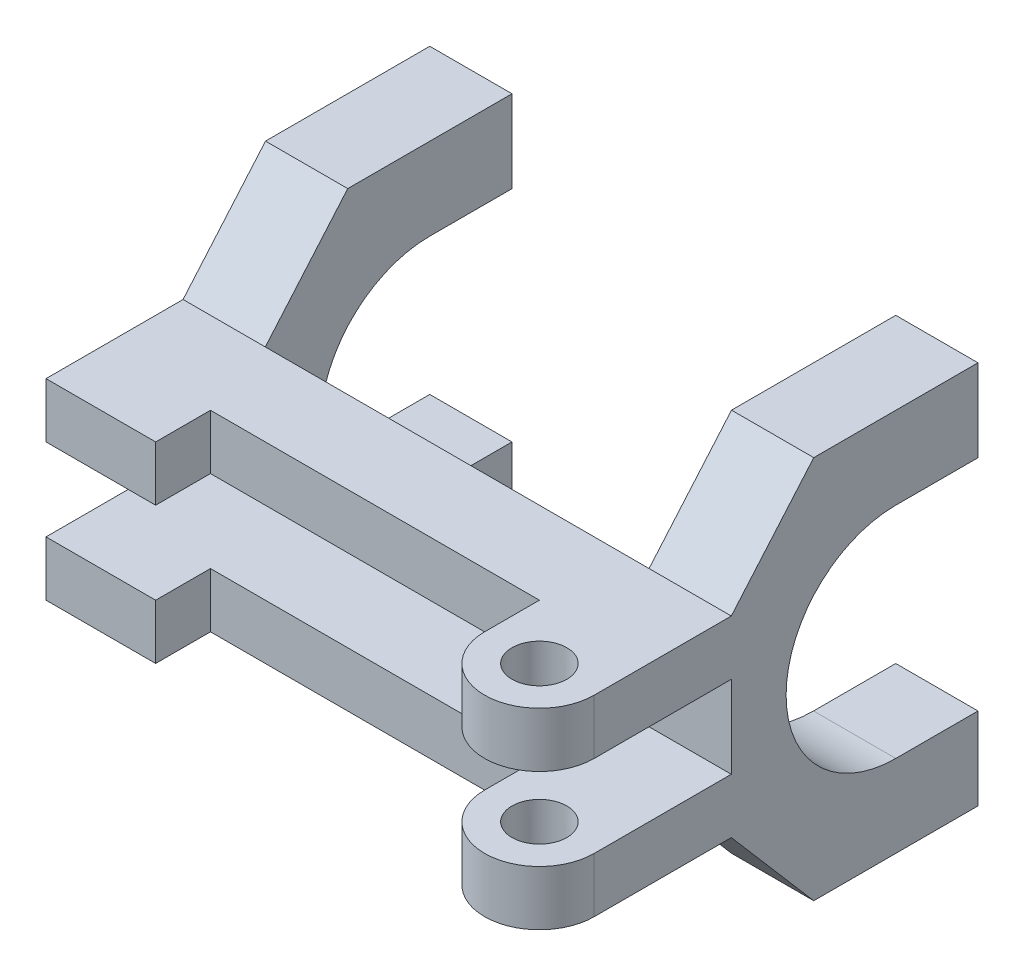
from build123d import *

# Parameters (mm, degrees)
SKETCH1_W           = 12.7
SKETCH1_H           = 44.45
BOSS_EXTRUDE1_DEPTH = 127
SKETCH2_R           = 6.35
CUT_EXTRUDE1_DEPTH  = 142.028625197
SKETCH4_W           = 88.9
SKETCH4_H           = 57.15
CUT_EXTRUDE2_DEPTH  = 147.187978302


with BuildPart() as part:
    # Sketch1 → Boss-Extrude1 (new body)
    with BuildSketch(Plane.YZ):
        with BuildLine():
            ThreePointArc((15.875, -38.1), (8.435512242, -20.139487758), (-9.525, -12.7))
            Line((-9.525, -12.7), (-9.525, 0))
            Line((-9.525, 0), (0, 0))
            Line((0, 0), (0, 44.45))
            Line((0, 44.45), (12.7, 44.45))
            Line((12.7, 44.45), (12.7, 0))
            Line((12.7, 0), (34.925, -19.098767483))
            Line((34.925, -19.098767483), (34.925, -57.15))
            Line((34.925, -57.15), (15.875, -57.15))
            Line((15.875, -57.15), (15.875, -38.1))
        make_face()
        with Locations((6.35, 22.225)):
            Rectangle(SKETCH1_W, SKETCH1_H)
    extrude(amount=-BOSS_EXTRUDE1_DEPTH)

    # Sketch2 → Cut-Extrude1 (cut, through all)
    with BuildSketch(Plane(origin=(0, 12.7, 0), x_dir=(-1, 0, 0), z_dir=(0, 1, 0))):
        with BuildLine():
            Line((101.6, 31.75), (127, 31.75))
            Line((127, 31.75), (127, 44.45))
            Line((127, 44.45), (12.700000053, 44.45))
            ThreePointArc((12.700000053, 44.45), (21.68025614, 40.730256102), (25.4, 31.75))
            Line((25.4, 31.75), (25.4, 19.05))
            Line((25.4, 19.05), (101.6, 19.05))
            Line((101.6, 19.05), (101.6, 31.75))
        make_face()
        with BuildLine():
            ThreePointArc((0, 31.75), (3.719743898, 40.73025614), (12.700000053, 44.45))
            Line((12.700000053, 44.45), (0, 44.45))
            Line((0, 44.45), (0, 31.75))
        make_face()
        with Locations(Location((12.7, 31.75, 0), (0, 0, 90))):
            Circle(SKETCH2_R)
    extrude(amount=-CUT_EXTRUDE1_DEPTH, mode=Mode.SUBTRACT)

    # Sketch4 → Cut-Extrude2 (cut, through all)
    with BuildSketch(Plane(origin=(0, 34.925, 0), x_dir=(-1, 0, 0), z_dir=(0, 1, 0))):
        with Locations((63.5, -28.575)):
            Rectangle(SKETCH4_W, SKETCH4_H)
    extrude(amount=-CUT_EXTRUDE2_DEPTH, mode=Mode.SUBTRACT)

    # Mirror1: part across plane


with BuildPart() as part_1:
    add(part.part)
    add(part.part.mirror(Plane(origin=(-127, -9.525, 0), x_dir=(0, 0, 1), z_dir=(0, -1, 0))))


solid = part_1.part
